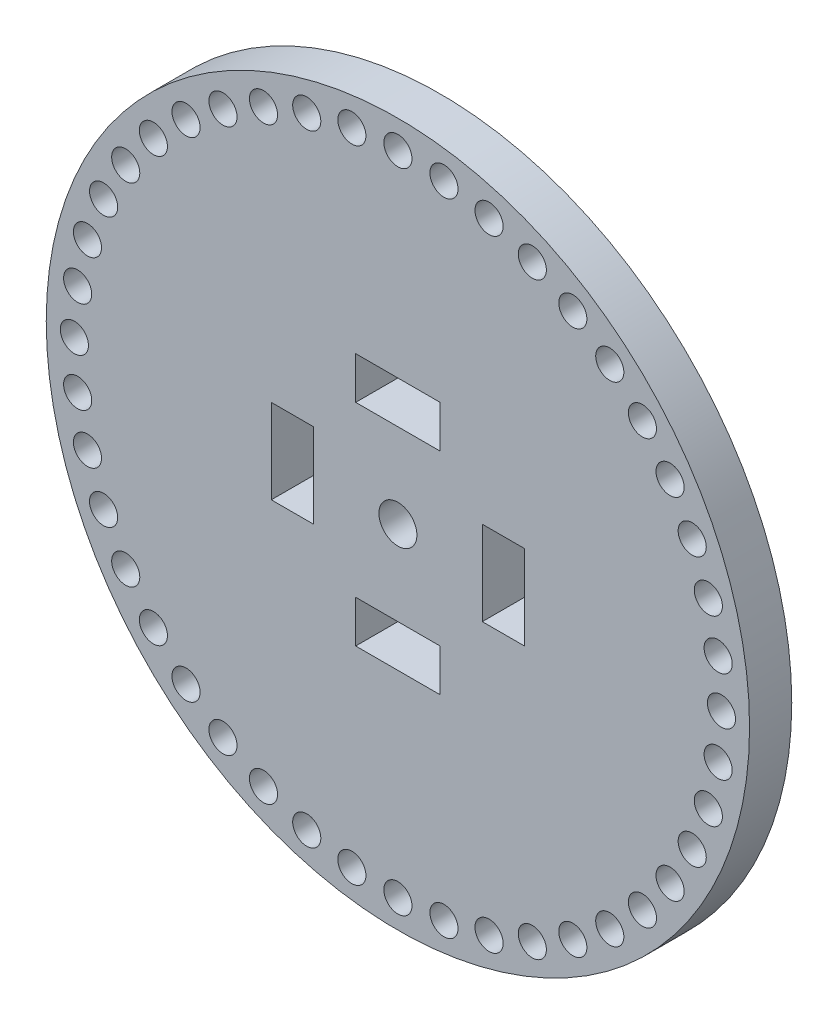
from build123d import *

# Parameters (mm, degrees)
SKETCH1_R           = 25
BOSS_EXTRUDE1_DEPTH = 3
SKETCH6_R           = 1
CUT_EXTRUDE3_DEPTH  = 3
SKETCH7_R           = 1.35
CUT_EXTRUDE4_DEPTH  = 3
SKETCH10_W          = 6
SKETCH10_H          = 3
SKETCH10_W_2        = 3
SKETCH10_H_2        = 6
CUT_EXTRUDE5_DEPTH  = 3


with BuildPart() as part:
    # Sketch1 → Boss-Extrude1 (new body)
    with BuildSketch(Plane.XY):
        Circle(SKETCH1_R)
    extrude(amount=BOSS_EXTRUDE1_DEPTH)

    # Sketch6 → Cut-Extrude3 (cut)
    with BuildSketch(Plane.XY.offset(3)):
        with Locations((0, 23)):
            Circle(SKETCH6_R)
        with Locations((3.27324128, 22.765893163)):
            Circle(SKETCH6_R)
        with Locations((6.479848807, 22.068338393)):
            Circle(SKETCH6_R)
        with Locations((9.554545299, 20.921535893)):
            Circle(SKETCH6_R)
        with Locations((12.434738801, 19.348831255)):
            Circle(SKETCH6_R)
        with Locations((15.061796881, 17.38224021)):
            Circle(SKETCH6_R)
        with Locations((17.38224021, 15.061796881)):
            Circle(SKETCH6_R)
        with Locations((19.348831255, 12.434738801)):
            Circle(SKETCH6_R)
        with Locations((20.921535893, 9.554545299)):
            Circle(SKETCH6_R)
        with Locations((22.068338393, 6.479848807)):
            Circle(SKETCH6_R)
        with Locations((22.765893163, 3.27324128)):
            Circle(SKETCH6_R)
        with Locations((23, 0)):
            Circle(SKETCH6_R)
        with Locations((22.765893163, -3.27324128)):
            Circle(SKETCH6_R)
        with Locations((22.068338393, -6.479848807)):
            Circle(SKETCH6_R)
        with Locations((20.921535893, -9.554545299)):
            Circle(SKETCH6_R)
        with Locations((19.348831255, -12.434738801)):
            Circle(SKETCH6_R)
        with Locations((17.38224021, -15.061796881)):
            Circle(SKETCH6_R)
        with Locations((15.061796881, -17.38224021)):
            Circle(SKETCH6_R)
        with Locations((12.434738801, -19.348831255)):
            Circle(SKETCH6_R)
        with Locations((9.554545299, -20.921535893)):
            Circle(SKETCH6_R)
        with Locations((6.479848807, -22.068338393)):
            Circle(SKETCH6_R)
        with Locations((3.27324128, -22.765893163)):
            Circle(SKETCH6_R)
        with Locations((0, -23)):
            Circle(SKETCH6_R)
        with Locations((-3.27324128, -22.765893163)):
            Circle(SKETCH6_R)
        with Locations((-6.479848807, -22.068338393)):
            Circle(SKETCH6_R)
        with Locations((-9.554545299, -20.921535893)):
            Circle(SKETCH6_R)
        with Locations((-12.434738801, -19.348831255)):
            Circle(SKETCH6_R)
        with Locations((-15.061796881, -17.38224021)):
            Circle(SKETCH6_R)
        with Locations((-17.38224021, -15.061796881)):
            Circle(SKETCH6_R)
        with Locations((-19.348831255, -12.434738801)):
            Circle(SKETCH6_R)
        with Locations((-20.921535893, -9.554545299)):
            Circle(SKETCH6_R)
        with Locations((-22.068338393, -6.479848807)):
            Circle(SKETCH6_R)
        with Locations((-22.765893163, -3.27324128)):
            Circle(SKETCH6_R)
        with Locations((-23, 0)):
            Circle(SKETCH6_R)
        with Locations((-22.765893163, 3.27324128)):
            Circle(SKETCH6_R)
        with Locations((-22.068338393, 6.479848807)):
            Circle(SKETCH6_R)
        with Locations((-20.921535893, 9.554545299)):
            Circle(SKETCH6_R)
        with Locations((-19.348831255, 12.434738801)):
            Circle(SKETCH6_R)
        with Locations((-17.38224021, 15.061796881)):
            Circle(SKETCH6_R)
        with Locations((-15.061796881, 17.38224021)):
            Circle(SKETCH6_R)
        with Locations((-12.434738801, 19.348831255)):
            Circle(SKETCH6_R)
        with Locations((-9.554545299, 20.921535893)):
            Circle(SKETCH6_R)
        with Locations((-6.479848807, 22.068338393)):
            Circle(SKETCH6_R)
        with Locations((-3.27324128, 22.765893163)):
            Circle(SKETCH6_R)
    extrude(amount=-CUT_EXTRUDE3_DEPTH, mode=Mode.SUBTRACT)

    # Sketch7 → Cut-Extrude4 (cut)
    with BuildSketch(Plane.XY.offset(3)):
        Circle(SKETCH7_R)
    extrude(amount=-CUT_EXTRUDE4_DEPTH, mode=Mode.SUBTRACT)

    # Sketch10 → Cut-Extrude5 (cut)
    with BuildSketch(Plane.XY.offset(3)):
        with Locations((0, 7.5)):
            Rectangle(SKETCH10_W, SKETCH10_H)
        with Locations((7.5, 0)):
            Rectangle(SKETCH10_W_2, SKETCH10_H_2)
        with Locations((0, -7.5)):
            Rectangle(SKETCH10_W, SKETCH10_H)
        with Locations((-7.5, 0)):
            Rectangle(SKETCH10_W_2, SKETCH10_H_2)
    extrude(amount=-CUT_EXTRUDE5_DEPTH, mode=Mode.SUBTRACT)


solid = part.part
